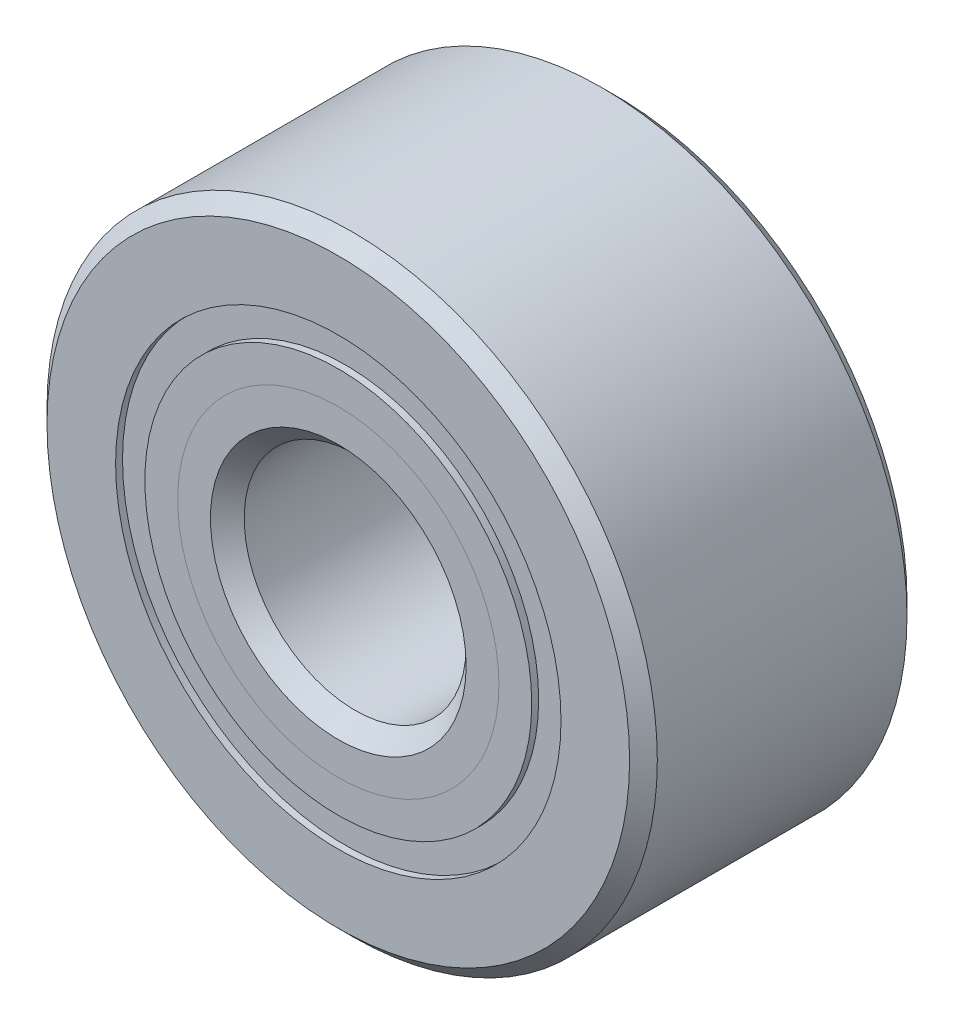
from build123d import *

# Parameters (mm, degrees)
CIRPATTERN1_COUNT = 8
SKETCH5_W         = 1.957414803
SKETCH5_H         = 0.837362638


with BuildPart() as part:
    # Sketch1 → Revolve1 (revolve)
    with BuildSketch(Plane(origin=(0, 0, 0), x_dir=(0, 0, -1), z_dir=(1, 0, 0))):
        with BuildLine():
            Line((3.571875, 8.73125), (-3.571875, 8.73125))
            Line((-3.571875, 8.73125), (-3.96875, 8.334375))
            Line((-3.96875, 8.334375), (-3.96875, 6.371806319))
            Line((-3.96875, 6.371806319), (-1.763888889, 6.371806319))
            ThreePointArc((-1.763888889, 6.371806319), (0, 7.766022697), (1.763888889, 6.371806319))
            Line((1.763888889, 6.371806319), (3.96875, 6.371806319))
            Line((3.96875, 6.371806319), (3.96875, 8.334375))
            Line((3.96875, 8.334375), (3.571875, 8.73125))
        make_face()
    revolve(axis=Axis((0, 0, 3.96875), (0, 0, -1)))


with BuildPart() as body_2:
    # Sketch2 → Revolve2 (revolve)
    with BuildSketch(Plane(origin=(0, 0, 0), x_dir=(0, 0, -1), z_dir=(1, 0, 0))):
        with BuildLine():
            Line((-3.96875, 5.534443681), (-1.763888889, 5.534443681))
            ThreePointArc((-1.763888889, 5.534443681), (-1.124182294, 4.530868965), (0, 4.140227303))
            Line((0, 4.140227303), (0, 3.657613652))
            Line((0, 3.657613652), (-3.030334985, 3.657613652))
            Line((-3.030334985, 3.657613652), (-3.96875, 4.596028666))
            Line((-3.96875, 4.596028666), (-3.96875, 5.534443681))
        make_face()
    revolve(axis=Axis((0, 0, 3.96875), (0, 0, -1)))


with BuildPart() as body_3:
    # Sketch3 → Revolve3 (revolve)
    with BuildSketch(Plane(origin=(0, 0, 0), x_dir=(0, 0, -1), z_dir=(1, 0, 0))):
        with BuildLine():
            Line((-3.96875, 4.596028666), (-3.030334985, 3.657613652))
            Line((-3.030334985, 3.657613652), (0, 3.657613652))
            Line((0, 3.657613652), (0, 4.140227303))
            ThreePointArc((0, 4.140227303), (1.124182294, 4.530868965), (1.763888889, 5.534443681))
            Line((1.763888889, 5.534443681), (3.96875, 5.534443681))
            Line((3.96875, 5.534443681), (3.96875, 3.571875))
            Line((3.96875, 3.571875), (3.571875, 3.175))
            Line((3.571875, 3.175), (-3.486136348, 3.175))
            Line((-3.486136348, 3.175), (-3.96875, 3.657613652))
            Line((-3.96875, 3.657613652), (-3.96875, 4.596028666))
        make_face()
    revolve(axis=Axis((0, 0, 3.96875), (0, 0, -1)))


with BuildPart() as body_4:
    # Sketch4 → Revolve4 (revolve)
    with BuildSketch(Plane(origin=(0, 0, 0), x_dir=(0, 0, -1), z_dir=(1, 0, 0))):
        with BuildLine():
            Line((-1.812897697, 5.953125), (1.812897697, 5.953125))
            ThreePointArc((1.812897697, 5.953125), (0, 7.766022697), (-1.812897697, 5.953125))
        make_face()
    revolve(axis=Axis((0, 5.953125, 1.812897697), (0, 0, -1)))


with BuildPart() as cirpattern1_1:
    # CirPattern1: pattern copy
    add(body_4.part.rotate(Axis((0, 0, -3.96875), (0, 0, 1)), 1 * 360 / CIRPATTERN1_COUNT))


with BuildPart() as cirpattern1_2:
    # CirPattern1: pattern copy
    add(body_4.part.rotate(Axis((0, 0, -3.96875), (0, 0, 1)), 2 * 360 / CIRPATTERN1_COUNT))


with BuildPart() as cirpattern1_3:
    # CirPattern1: pattern copy
    add(body_4.part.rotate(Axis((0, 0, -3.96875), (0, 0, 1)), 3 * 360 / CIRPATTERN1_COUNT))


with BuildPart() as cirpattern1_4:
    # CirPattern1: pattern copy
    add(body_4.part.rotate(Axis((0, 0, -3.96875), (0, 0, 1)), 4 * 360 / CIRPATTERN1_COUNT))


with BuildPart() as cirpattern1_5:
    # CirPattern1: pattern copy
    add(body_4.part.rotate(Axis((0, 0, -3.96875), (0, 0, 1)), 5 * 360 / CIRPATTERN1_COUNT))


with BuildPart() as cirpattern1_6:
    # CirPattern1: pattern copy
    add(body_4.part.rotate(Axis((0, 0, -3.96875), (0, 0, 1)), 6 * 360 / CIRPATTERN1_COUNT))


with BuildPart() as cirpattern1_7:
    # CirPattern1: pattern copy
    add(body_4.part.rotate(Axis((0, 0, -3.96875), (0, 0, 1)), 7 * 360 / CIRPATTERN1_COUNT))


with BuildPart() as body_12:
    # Sketch5 → Revolve5 (revolve)
    with BuildSketch(Plane(origin=(0, 0, 0), x_dir=(0, 0, -1), z_dir=(1, 0, 0))):
        with Locations((-2.791605099, 5.953125)):
            Rectangle(SKETCH5_W, SKETCH5_H)
        with Locations((2.791605099, 5.953125)):
            Rectangle(SKETCH5_W, SKETCH5_H)
    revolve(axis=Axis((0, 0, 3.96875), (0, 0, -1)))


solid = Compound([part.part, body_2.part, body_3.part, body_4.part, cirpattern1_1.part, cirpattern1_2.part, cirpattern1_3.part, cirpattern1_4.part, cirpattern1_5.part, cirpattern1_6.part, cirpattern1_7.part, body_12.part])
